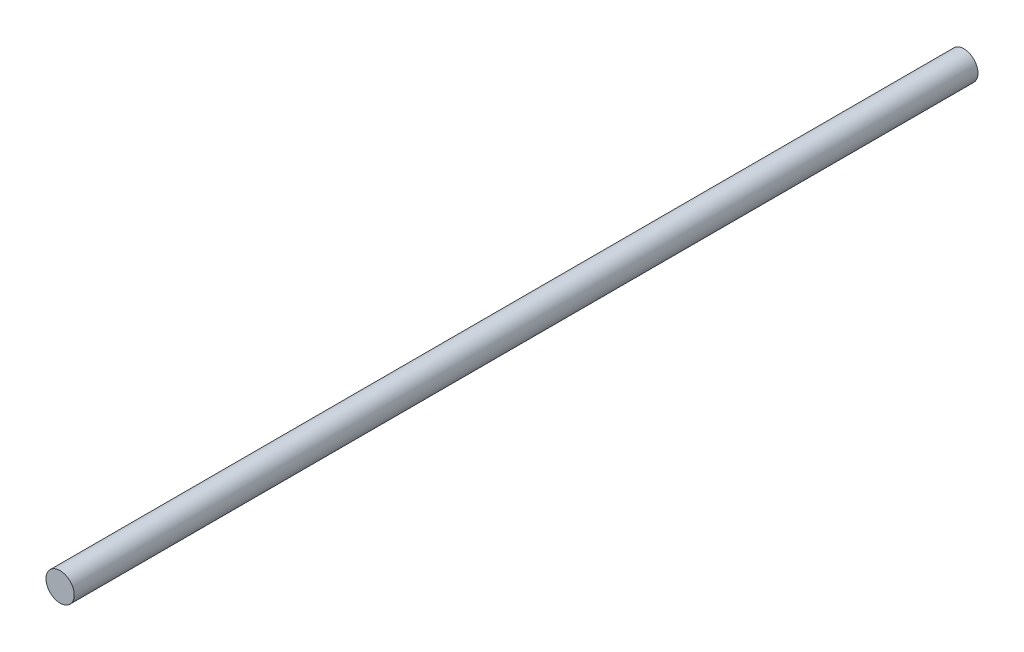
from build123d import *

# Parameters (mm, degrees)
SKETCH_1_R      = 2.5
EXTRUDE_1_DEPTH = 160


with BuildPart() as part:
    # 草图1 → 凸台-拉伸1 (new body)
    with BuildSketch(Plane.XY):
        Circle(SKETCH_1_R)
    extrude(amount=EXTRUDE_1_DEPTH)


solid = part.part
